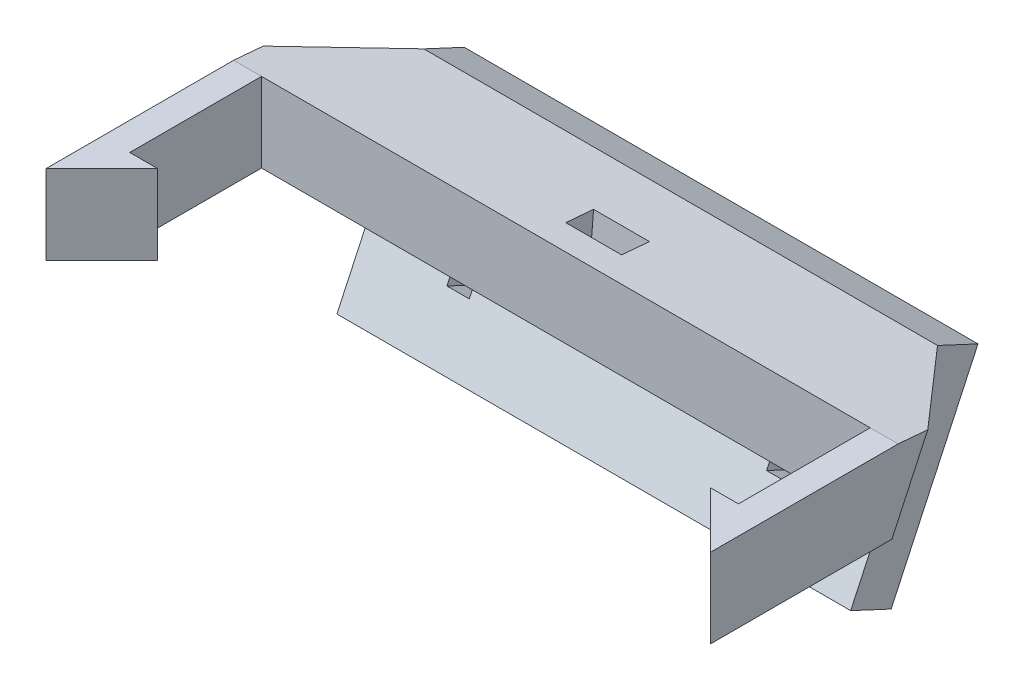
from build123d import *

# Parameters (mm, degrees)
SKETCH1_W                      = 75.565
SKETCH1_H                      = 35.56
BOSS_EXTRUDE1_DEPTH            = 3.175
SKETCH6_W                      = 3.175
SKETCH6_H                      = 9.028368652
BOSS_EXTRUDE4_DEPTH            = 14.986
BOSS_EXTRUDE6_DEPTH            = 9.028368652
BOSS_EXTRUDE7_DEPTH            = 75.565
SKETCH10_W                     = 75.565
SKETCH10_H                     = 23.368
BOSS_EXTRUDE8_DEPTH            = 5.08
CUT_EXTRUDE1_DEPTH             = 82.008490267
CUT_EXTRUDE2_REACH             = 51.95
SKETCH12_W                     = 6.35
SKETCH12_H                     = 3.175
CUT_EXTRUDE2_DIRECTION_2_DEPTH = 50.950000932
CUT_EXTRUDE3_DEPTH             = 54.096105705
CUT_EXTRUDE4_REACH             = 55.451
SKETCH14_W                     = 2.54
SKETCH14_H                     = 3.81


with BuildPart() as part:
    # Sketch1 → Boss-Extrude1 (new body)
    with BuildSketch(Plane.XY):
        Rectangle(SKETCH1_W, SKETCH1_H)
    extrude(amount=-BOSS_EXTRUDE1_DEPTH)

    # Sketch6 → Boss-Extrude4 (add)
    with BuildSketch(Plane.XY):
        with Locations((-36.195, 0)):
            Rectangle(SKETCH6_W, SKETCH6_H)
        with Locations((36.195, 0)):
            Rectangle(SKETCH6_W, SKETCH6_H)
    extrude(amount=BOSS_EXTRUDE4_DEPTH)

    # Sketch8 → Boss-Extrude6 (add)
    with BuildSketch(Plane.XZ.offset(4.514184326)):
        Polygon((-37.7825, 14.986), (-31.4325, 14.986), (-37.7825, 21.336), align=None)
        Polygon((37.7825, 14.986), (31.4325, 14.986), (37.7825, 21.336), align=None)
    extrude(amount=-BOSS_EXTRUDE6_DEPTH)

    # Sketch9 → Boss-Extrude7 (add)
    with BuildSketch(Plane.ZY.offset(37.7825)):
        Polygon((-3.175, 17.78), (-16.795270199, 11.4287637), (-3.175, -17.78), align=None)
    extrude(amount=-BOSS_EXTRUDE7_DEPTH)

    # Sketch10 → Boss-Extrude8 (add)
    with BuildSketch(Plane(origin=(0, -4.391713703, -9.41806043), x_dir=(-1, 0, 0), z_dir=(0, -0.4226182617407007, -0.9063077870366493))):
        with Locations((0, -3.088339472)):
            Rectangle(SKETCH10_W, SKETCH10_H)
    extrude(amount=BOSS_EXTRUDE8_DEPTH)

    # Sketch11 → Cut-Extrude1 (cut, through all)
    with BuildSketch(Plane.ZY.offset(37.7825)):
        Polygon((-13.05074354, 3.398600367), (0, 4.514184326), (36.888684706, 18.275511072), (5.286071508, 25.150339228), (-30.3838484, 8.233222823), align=None)
        Polygon((-3.175, -17.78), (-7.689027521, -8.099636743), (0, -4.514184326), (40.158547499, -20.406390647), (15.599703883, -25.394905756), align=None)
    extrude(amount=-CUT_EXTRUDE1_DEPTH, mode=Mode.SUBTRACT)

    # Cut-Extrude2: up to this plane
    cut_extrude2_end = Plane(origin=(37.7825, -8.099636743, -7.689027521), z_dir=(0, 0.9063077870366495, -0.4226182617407008))
    # Sketch12 → Cut-Extrude2 (cut, up to the surface)
    with BuildSketch(Plane(origin=(0, 4.481438837, -0.38307559), x_dir=(1, 0, 0), z_dir=(0, 0.9963664433600627, -0.08516989225083536)), mode=Mode.PRIVATE) as cut_extrude2_sk1:
        with Locations((0, 4.378027407)):
            Rectangle(SKETCH12_W, SKETCH12_H)
    cut_extrude2_tool1 = split(extrude(cut_extrude2_sk1.sketch, amount=-CUT_EXTRUDE2_REACH, mode=Mode.PRIVATE), bisect_by=cut_extrude2_end, keep=Keep.BOTH, mode=Mode.PRIVATE)
    add(cut_extrude2_tool1.solids().sort_by_distance((0, 4.108563, -4.745195))[0], mode=Mode.SUBTRACT)

    # Sketch12 → Cut-Extrude2 direction 2 (cut)
    with BuildSketch(Plane(origin=(0, 4.481438837, -0.38307559), x_dir=(1, 0, 0), z_dir=(0, 0.9963664433600627, -0.08516989225083536))):
        with Locations((0, 4.378027407)):
            Rectangle(SKETCH12_W, SKETCH12_H)
    extrude(amount=CUT_EXTRUDE2_DIRECTION_2_DEPTH, mode=Mode.SUBTRACT)

    # Sketch13 → Cut-Extrude3 (cut, through all)
    with BuildSketch(Plane(origin=(0, 7.790314071, -3.632683111), x_dir=(1, 0, 0), z_dir=(0, 0.9063077870366493, -0.4226182617407007))):
        Polygon((-29.21, 10.391679918), (-37.7825, 1.267223267), (-37.7825, 11.639630657), (-37.7825, 15.471679918), (-29.21, 15.471679918), align=None)
        Polygon((37.7825, 1.267223267), (37.7825, 11.639630657), (37.7825, 15.471679918), (29.21, 15.471679918), (29.21, 10.391679918), align=None)
    extrude(amount=-CUT_EXTRUDE3_DEPTH, mode=Mode.SUBTRACT)

    # Sketch14 → Cut-Extrude4 (cut, up to next)
    with BuildSketch(Plane(origin=(0, -6.538614473, -14.022103988), x_dir=(-1, 0, 0), z_dir=(0, -0.4226182617407007, -0.9063077870366494)), mode=Mode.PRIVATE) as cut_extrude4_sk1:
        with Locations((-18.050542255, -6.082892111)):
            Rectangle(SKETCH14_W, SKETCH14_H)
    cut_extrude4_tool1 = extrude(cut_extrude4_sk1.sketch, amount=-CUT_EXTRUDE4_REACH, mode=Mode.PRIVATE) & part.part
    # Sketch14 → Cut-Extrude4 (cut, up to next)
    with BuildSketch(Plane(origin=(0, -6.538614473, -14.022103988), x_dir=(-1, 0, 0), z_dir=(0, -0.4226182617407007, -0.9063077870366494)), mode=Mode.PRIVATE) as cut_extrude4_sk2:
        with Locations((18.295855998, -6.082892111)):
            Rectangle(SKETCH14_W, SKETCH14_H)
    cut_extrude4_tool2 = extrude(cut_extrude4_sk2.sketch, amount=-CUT_EXTRUDE4_REACH, mode=Mode.PRIVATE) & part.part
    add(cut_extrude4_tool1.solids().sort_by_distance((18.050542, -12.051587, -11.451363))[0], mode=Mode.SUBTRACT)
    add(cut_extrude4_tool2.solids().sort_by_distance((-18.295856, -12.051587, -11.451363))[0], mode=Mode.SUBTRACT)


solid = part.part
